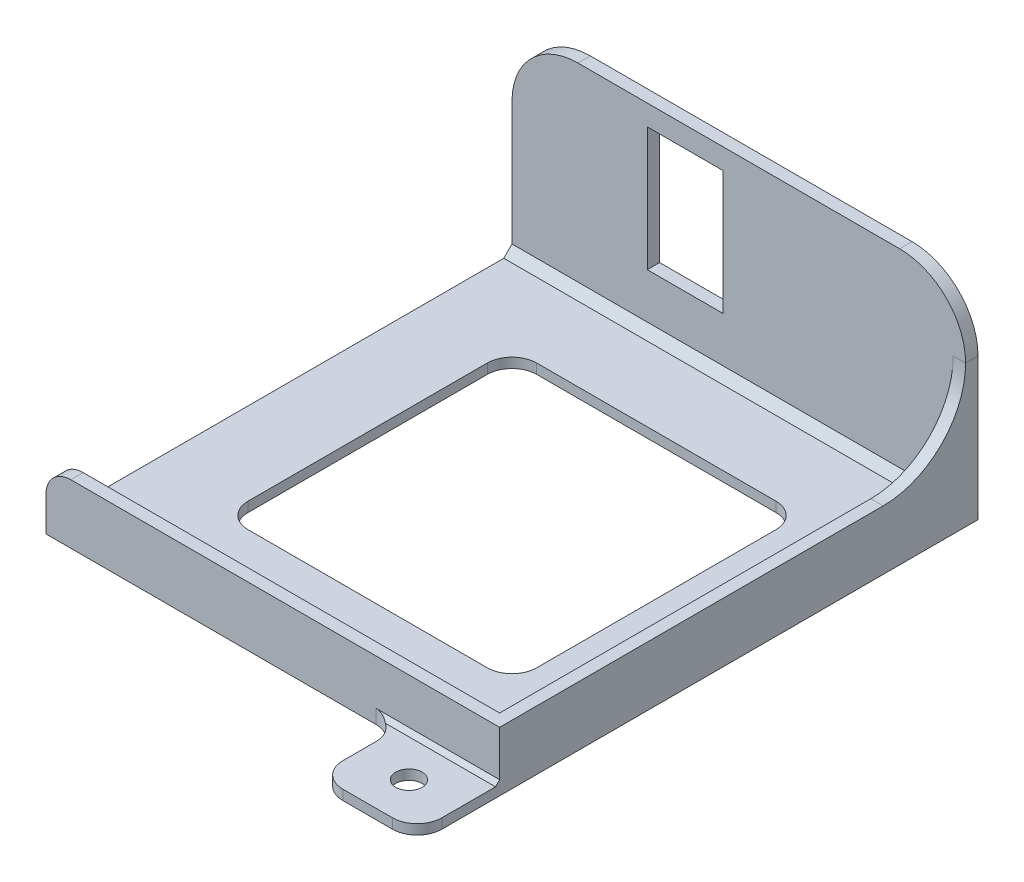
from build123d import *

# Parameters (mm, degrees)
ESBO_O1_W                = 55
ESBO_O1_H                = 58
BASE_DEPTH               = 1.2
ESBO_O2_W                = 55
ESBO_O2_H                = 58
ESBO_O2_W_2              = 52
ESBO_O2_H_2              = 55
PAREDES_DEPTH            = 24
ESBO_O3_W                = 4.971937724
ESBO_O3_H                = 55
CORTE_EXTRUS_O1_DEPTH    = 24
ESBO_O4_W                = 9.2
ESBO_O4_H                = 15
ENCAIXE_CHAVE_DEPTH      = 17
ESBO_O5_W                = 1.5
ESBO_O5_H                = 18
CORTE_EXTRUS_O3_DEPTH    = 68.089790579
FILETE1_R                = 8
FILETE2_R                = 3
CHANFRO1_SIZE            = 1
CORTE_EXTRUS_O5_DEPTH    = 17
ESBO_O8_W                = 55
ESBO_O8_H                = 18
CORTE_EXTRUS_O6_DEPTH    = 17
FILETE6_R                = 8
FILETE7_R                = 10
ESBO_O9_W                = 12
ESBO_O9_H                = 1.2
RESSALTO_EXTRUS_O3_DEPTH = 10
ESBO_O10_R               = 1.6
CORTE_EXTRUS_O7_DEPTH    = 10
FILETE8_R                = 3
FILETE9_R                = 3
FILETE10_R               = 3
CHANFRO2_SIZE            = 0.5


with BuildPart() as part:
    # Esboço1 → Base (new body)
    with BuildSketch(Plane(origin=(0, 0, 0), x_dir=(1, 0, 0), z_dir=(0, 1, 0))):
        Rectangle(ESBO_O1_W, ESBO_O1_H)
    extrude(amount=BASE_DEPTH)

    # Esboço2 → Paredes (add)
    with BuildSketch(Plane(origin=(0, 1.2, 0), x_dir=(1, 0, 0), z_dir=(0, 1, 0))):
        Rectangle(ESBO_O2_W, ESBO_O2_H)
        Rectangle(ESBO_O2_W_2, ESBO_O2_H_2, mode=Mode.SUBTRACT)
    extrude(amount=PAREDES_DEPTH)

    # Esboço3 → Corte-extrusão1 (cut)
    with BuildSketch(Plane(origin=(0, 25.2, 0), x_dir=(1, 0, 0), z_dir=(0, 1, 0))):
        with Locations((-27.5, 0)):
            Rectangle(ESBO_O3_W, ESBO_O3_H)
    extrude(amount=-CORTE_EXTRUS_O1_DEPTH, mode=Mode.SUBTRACT)

    # Esboço4 → Encaixe chave (cut)
    with BuildSketch(Plane(origin=(0, 0, -29), x_dir=(-1, 0, 0), z_dir=(0, 0, -1))):
        with Locations((6.5, 15.2)):
            Rectangle(ESBO_O4_W, ESBO_O4_H)
    extrude(amount=-ENCAIXE_CHAVE_DEPTH, mode=Mode.SUBTRACT)

    # Esboço5 → Corte-extrusão3 (cut, through all)
    with BuildSketch(Plane.ZY.offset(27.5)):
        with Locations((28.25, 16.2)):
            Rectangle(ESBO_O5_W, ESBO_O5_H)
    extrude(amount=-CORTE_EXTRUS_O3_DEPTH, mode=Mode.SUBTRACT)

    # Filete1
    filete1_edges = [part.edges().sort_by_distance(p)[0] for p in [
        (-27.5, 25.2, -28.25),
    ]]
    fillet(filete1_edges, radius=FILETE1_R)

    # Filete2
    filete2_edges = [part.edges().sort_by_distance(p)[0] for p in [
        (-27.5, 7.2, 28.25),
    ]]
    fillet(filete2_edges, radius=FILETE2_R)

    # Chanfro1
    chanfro1_edges = [part.edges().sort_by_distance(p)[0] for p in [
        (26, 1.2, 0),
        (-0.75, 1.2, -27.5),
        (-0.75, 1.2, 27.5),
    ]]
    chamfer(chanfro1_edges, length=CHANFRO1_SIZE)

    # Esboço7 → Corte-extrusão5 (cut)
    with BuildSketch(Plane(origin=(0, 1.2, 0), x_dir=(1, 0, 0), z_dir=(0, 1, 0))):
        with BuildLine():
            Line((-14.5, -17.5), (14.5, -17.5))
            ThreePointArc((14.5, -17.5), (16.621320344, -16.621320344), (17.5, -14.5))
            Line((17.5, -14.5), (17.5, 14.5))
            ThreePointArc((17.5, 14.5), (16.621320344, 16.621320344), (14.5, 17.5))
            Line((14.5, 17.5), (-14.5, 17.5))
            ThreePointArc((-14.5, 17.5), (-16.621320344, 16.621320344), (-17.5, 14.5))
            Line((-17.5, 14.5), (-17.5, -14.5))
            ThreePointArc((-17.5, -14.5), (-16.621320344, -16.621320344), (-14.5, -17.5))
        make_face()
    extrude(amount=-CORTE_EXTRUS_O5_DEPTH, mode=Mode.SUBTRACT)

    # Esboço8 → Corte-extrusão6 (cut)
    with BuildSketch(Plane(origin=(27.5, 0, 0), x_dir=(0, 0, -1), z_dir=(1, 0, 0))):
        with Locations((0, 16.2)):
            Rectangle(ESBO_O8_W, ESBO_O8_H)
    extrude(amount=-CORTE_EXTRUS_O6_DEPTH, mode=Mode.SUBTRACT)

    # Filete6
    filete6_edges = [part.edges().sort_by_distance(p)[0] for p in [
        (27.5, 25.2, -28.25),
    ]]
    fillet(filete6_edges, radius=FILETE6_R)

    # Filete7
    filete7_edges = [part.edges().sort_by_distance(p)[0] for p in [
        (26.75, 7.2, -27.5),
    ]]
    fillet(filete7_edges, radius=FILETE7_R)

    # Esboço9 → Ressalto-extrusão3 (add)
    with BuildSketch(Plane.XY.offset(29)):
        with Locations((21.5, 0.6)):
            Rectangle(ESBO_O9_W, ESBO_O9_H)
    extrude(amount=RESSALTO_EXTRUS_O3_DEPTH)

    # Esboço10 → Corte-extrusão7 (cut)
    with BuildSketch(Plane(origin=(0, 1.2, 0), x_dir=(1, 0, 0), z_dir=(0, 1, 0))):
        with Locations(Location((21.5, -34, 0), (0, 0, 180))):
            Circle(ESBO_O10_R)
    extrude(amount=-CORTE_EXTRUS_O7_DEPTH, mode=Mode.SUBTRACT)

    # Filete8
    filete8_edges = [part.edges().sort_by_distance(p)[0] for p in [
        (15.5, 0.6, 39),
    ]]
    fillet(filete8_edges, radius=FILETE8_R)

    # Filete9
    filete9_edges = [part.edges().sort_by_distance(p)[0] for p in [
        (27.5, 0.6, 39),
    ]]
    fillet(filete9_edges, radius=FILETE9_R)

    # Filete10
    filete10_edges = [part.edges().sort_by_distance(p)[0] for p in [
        (15.5, 0.6, 29),
    ]]
    fillet(filete10_edges, radius=FILETE10_R)

    # Chanfro2
    chanfro2_edges = [part.edges().sort_by_distance(p)[0] for p in [
        (20, 1.2, 29),
    ]]
    chamfer(chanfro2_edges, length=CHANFRO2_SIZE)


solid = part.part
